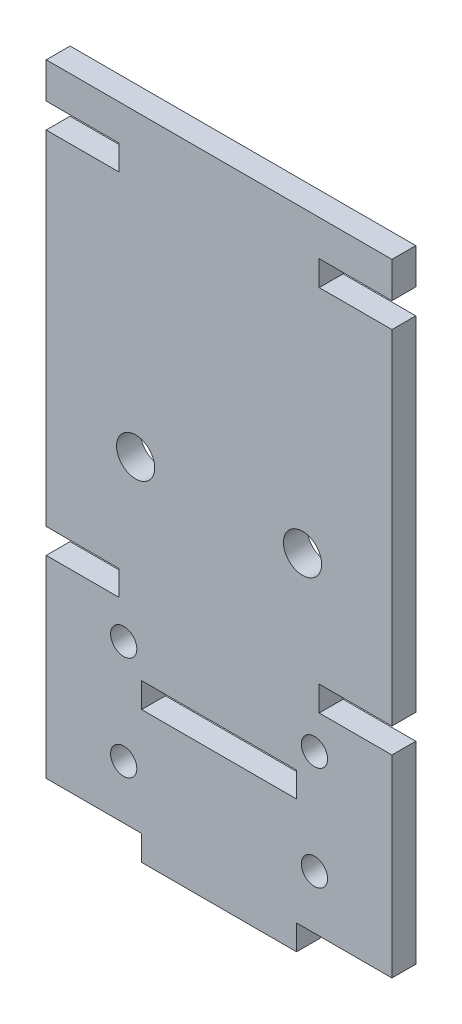
from build123d import *

# Parameters (mm, degrees)
SKETCH_1_W          = 8
SKETCH_1_H          = 2.1
SKETCH_1_W_2        = 13
EXTRUDE_1_DEPTH     = 2
SKETCH_2_W          = 6.1
SKETCH_2_H          = 2.1
CUT_EXTRUDE_1_DEPTH = 2
SKETCH_3_W          = 16.8
SKETCH_3_H          = 2.1
EXTRUDE_2_DEPTH     = 2
SKETCH_4_R          = 1.6
CUT_EXTRUDE_2_DEPTH = 2
SKETCH_5_R          = 1.1
CUT_EXTRUDE_5_DEPTH = 10
SKETCH_6_R          = 1.1
CUT_EXTRUDE_6_DEPTH = 10
EXTRUDE_3_DEPTH     = 2


with BuildPart() as part:
    # 草图1 → 凸台-拉伸1 (new body)
    with BuildSketch(Plane.XY):
        Polygon((-12.242924528, 31.300471698), (-12.242924528, -4.699528302), (-4.242924528, -4.699528302), (8.757075472, -4.699528302), (16.757075472, -4.699528302), (16.757075472, 31.300471698), align=None)
        Polygon((-12.242924528, -6.799528302), (-12.242924528, -15.799528302), (-4.242924528, -15.799528302), (8.757075472, -15.799528302), (16.757075472, -15.799528302), (16.757075472, -6.799528302), (8.757075472, -6.799528302), (-4.242924528, -6.799528302), align=None)
        with Locations((12.757075472, -5.749528302)):
            Rectangle(SKETCH_1_W, SKETCH_1_H)
        with Locations((-8.242924528, -5.749528302)):
            Rectangle(SKETCH_1_W, SKETCH_1_H)
        with Locations((2.257075472, -16.849528302)):
            Rectangle(SKETCH_1_W_2, SKETCH_1_H)
    extrude(amount=EXTRUDE_1_DEPTH)

    # 草图2 → 切除-拉伸1 (cut)
    with BuildSketch(Plane.XY.offset(2)):
        with Locations((13.707075472, 1.450471698)):
            Rectangle(SKETCH_2_W, SKETCH_2_H)
        with Locations((-9.192924528, 1.450471698)):
            Rectangle(SKETCH_2_W, SKETCH_2_H)
    extrude(amount=-CUT_EXTRUDE_1_DEPTH, mode=Mode.SUBTRACT)

    # 草图3 → 凸台-拉伸2 (add)
    with BuildSketch(Plane.XY.offset(2)):
        with Locations((2.257075472, 32.350471698)):
            Rectangle(SKETCH_3_W, SKETCH_3_H)
    extrude(amount=-EXTRUDE_2_DEPTH)

    # 草图4 → 切除-拉伸2 (cut)
    with BuildSketch(Plane.XY.offset(2)):
        with Locations((-4.742924528, 11.300471698)):
            Circle(SKETCH_4_R)
        with Locations(Location((9.257075472, 11.300471698, 0), (0, 0, 180))):
            Circle(SKETCH_4_R)
    extrude(amount=-CUT_EXTRUDE_2_DEPTH, mode=Mode.SUBTRACT)

    # 草图5 → 切除-拉伸5 (cut)
    with BuildSketch(Plane(origin=(0, 0, 0), x_dir=(-1, 0, 0), z_dir=(0, 0, -1))):
        with Locations((-10.257075472, -2.599528302)):
            Circle(SKETCH_5_R)
        with Locations((5.742924528, -2.599528302)):
            Circle(SKETCH_5_R)
    extrude(amount=-CUT_EXTRUDE_5_DEPTH, mode=Mode.SUBTRACT)

    # 草图6 → 切除-拉伸6 (cut)
    with BuildSketch(Plane.XY.offset(2)):
        with Locations((10.257075472, -11.299528302)):
            Circle(SKETCH_6_R)
        with Locations((-5.742924528, -11.299528302)):
            Circle(SKETCH_6_R)
    extrude(amount=-CUT_EXTRUDE_6_DEPTH, mode=Mode.SUBTRACT)

    # 草图7 → 凸台-拉伸3 (add)
    with BuildSketch(Plane.XY.offset(2)):
        Polygon((-6.142924528, 33.400471698), (-12.242924528, 33.400471698), (-12.242924528, 36.400471698), (16.757075472, 36.400471698), (16.757075472, 33.400471698), align=None)
    extrude(amount=-EXTRUDE_3_DEPTH)


solid = part.part
